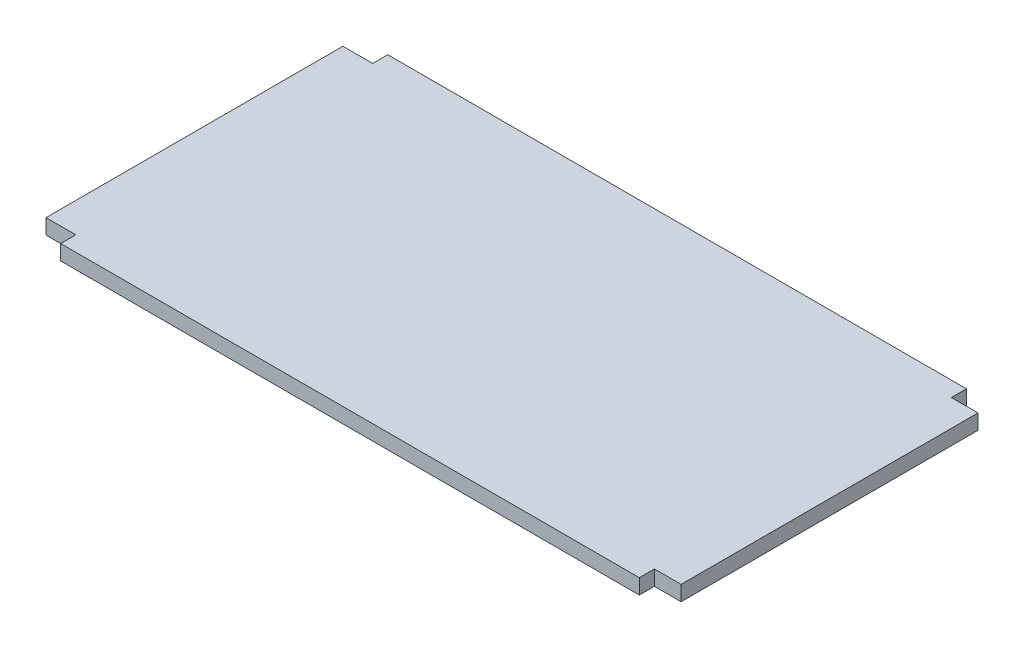
from build123d import *

# Parameters (mm, degrees)
BOSS_EXTRUDE1_DEPTH = 3


with BuildPart() as part:
    # Sketch1 → Boss-Extrude1 (new body)
    with BuildSketch(Plane(origin=(0, 0, 0), x_dir=(1, 0, 0), z_dir=(0, 1, 0))):
        Polygon((-57.5, 29.5), (-63.418, 29.5), (-63.418, -29.5), (-57.5, -29.5), (-57.5, -32.5), (57.5, -32.5), (57.5, -29.5), (62.806, -29.5), (62.806, 29.5), (57.5, 29.5), (57.5, 32.5), (-57.5, 32.5), align=None)
    extrude(amount=-BOSS_EXTRUDE1_DEPTH)


solid = part.part
